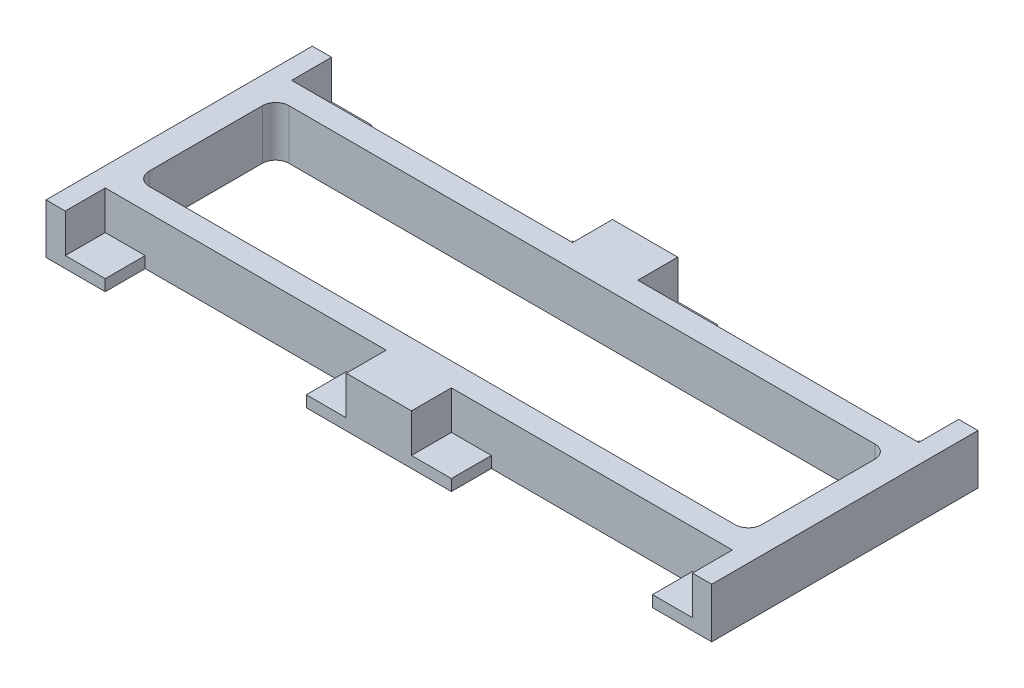
from build123d import *

# Parameters (mm, degrees)
SKETCH2_W            = 500
SKETCH2_H            = 200
BOSS_EXTRUDE1_DEPTH  = 37.5
CUT_EXTRUDE3_DEPTH   = 30
LPATTERN1_COUNT      = 2
LPATTERN1_PITCH      = 260
MIRROR1_COPY_1_DEPTH = 30
SKETCH7_W            = 460
SKETCH7_H            = 105
CUT_EXTRUDE4_DEPTH   = 160
FILLET1_R            = 10
FILLET2_R            = 10
FILLET3_R            = 10
FILLET4_R            = 10


with BuildPart() as part:
    # Sketch2 → Boss-Extrude1 (new body)
    with BuildSketch(Plane(origin=(0, 0, 0), x_dir=(1, 0, 0), z_dir=(0, 1, 0))):
        with Locations((0, 50)):
            Rectangle(SKETCH2_W, SKETCH2_H)
    extrude(amount=BOSS_EXTRUDE1_DEPTH)

    # Sketch5 → Cut-Extrude3 (cut)
    with BuildSketch(Plane(origin=(0, 0, -150), x_dir=(-1, 0, 0), z_dir=(0, 0, -1))):
        Polygon((24.5, 66.5), (54.5, 66.5), (54.5, 75), (205.5, 75), (205.5, 66.5), (235.5, 66.5), (235.5, 8.5), (205.5, 8.5), (205.5, 0), (54.5, 0), (54.5, 8.5), (24.5, 8.5), align=None)
    cut_extrude3 = extrude(amount=-CUT_EXTRUDE3_DEPTH, mode=Mode.SUBTRACT)

    # LPattern1: Cut-Extrude3 ×2
    with Locations(*[(i * LPATTERN1_PITCH, 0, 0) for i in range(1, LPATTERN1_COUNT)]):
        add(cut_extrude3, mode=Mode.SUBTRACT)

    # Mirror1: Cut-Extrude3 across plane
    add(cut_extrude3.mirror(Plane.XY.offset(-50)), mode=Mode.SUBTRACT)

    # Mirror1 copy 1 sketch → Mirror1 copy 1 (cut)
    with BuildSketch(Plane(origin=(260, 0, 50), x_dir=(-1, 0, 0), z_dir=(0, 0, 1))):
        Polygon((24.5, -66.5), (54.5, -66.5), (54.5, -75), (205.5, -75), (205.5, -66.5), (235.5, -66.5), (235.5, -8.5), (205.5, -8.5), (205.5, 0), (54.5, 0), (54.5, -8.5), (24.5, -8.5), align=None)
    extrude(amount=-MIRROR1_COPY_1_DEPTH, mode=Mode.SUBTRACT)

    # Sketch7 → Cut-Extrude4 (cut)
    with BuildSketch(Plane(origin=(0, 37.5, 0), x_dir=(1, 0, 0), z_dir=(0, 1, 0))):
        with Locations((0, 50)):
            Rectangle(SKETCH7_W, SKETCH7_H)
    extrude(amount=-CUT_EXTRUDE4_DEPTH, mode=Mode.SUBTRACT)

    # Fillet1
    fillet1_edges = [part.edges().sort_by_distance(p)[0] for p in [
        (-230, 18.75, -102.5),
    ]]
    fillet(fillet1_edges, radius=FILLET1_R)

    # Fillet2
    fillet2_edges = [part.edges().sort_by_distance(p)[0] for p in [
        (-230, 18.75, 2.5),
    ]]
    fillet(fillet2_edges, radius=FILLET2_R)

    # Fillet3
    fillet3_edges = [part.edges().sort_by_distance(p)[0] for p in [
        (230, 18.75, -102.5),
    ]]
    fillet(fillet3_edges, radius=FILLET3_R)

    # Fillet4
    fillet4_edges = [part.edges().sort_by_distance(p)[0] for p in [
        (230, 18.75, 2.5),
    ]]
    fillet(fillet4_edges, radius=FILLET4_R)


solid = part.part
